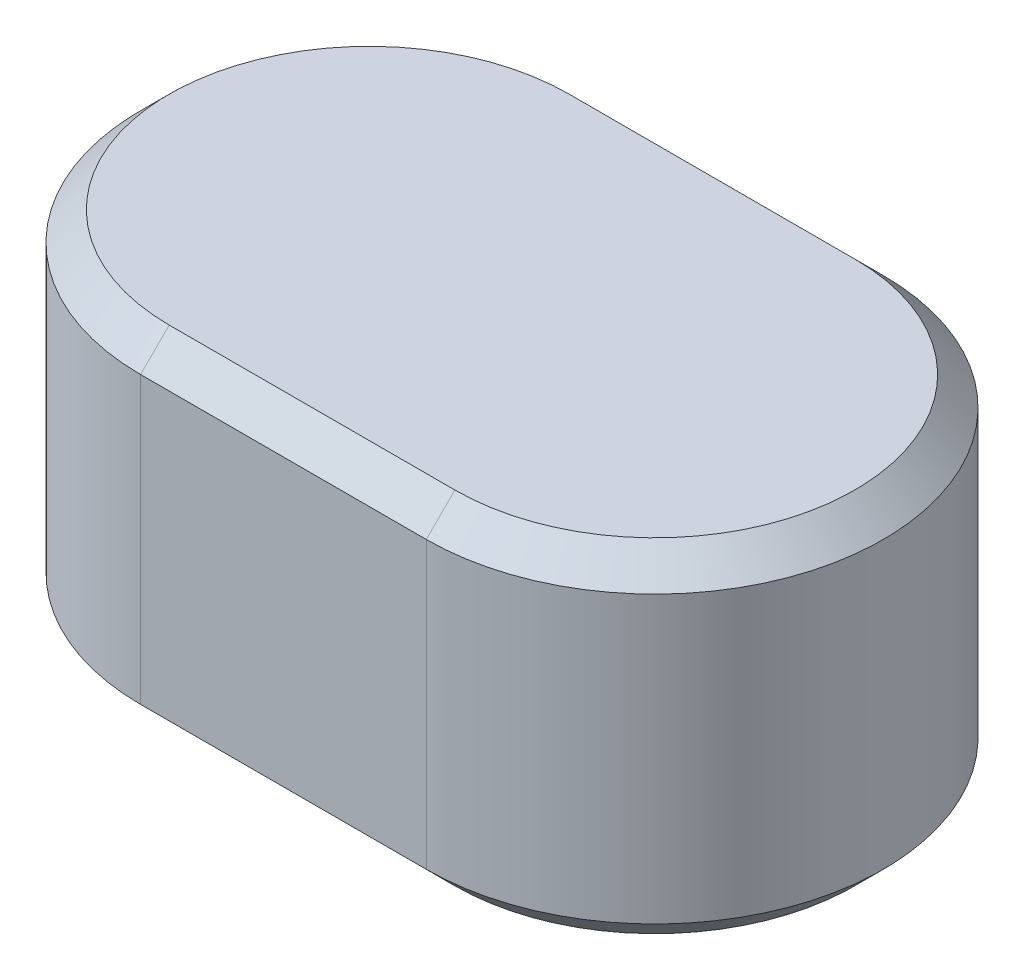
from build123d import *

# Parameters (mm, degrees)
ESTRUSIONE_ESTRUSIONE1_DEPTH = 6
SMUSSO1_SIZE                 = 0.5


with BuildPart() as part:
    # Schizzo1 → Estrusione-Estrusione1 (new body)
    with BuildSketch(Plane(origin=(0, 0, 0), x_dir=(1, 0, 0), z_dir=(0, 1, 0))):
        with BuildLine():
            Line((-2.5, 4), (2.5, 4))
            ThreePointArc((2.5, 4), (6.5, 0), (2.5, -4))
            Line((2.5, -4), (-2.5, -4))
            ThreePointArc((-2.5, -4), (-6.5, 0), (-2.5, 4))
        make_face()
    extrude(amount=ESTRUSIONE_ESTRUSIONE1_DEPTH)

    # Smusso1
    smusso1_edges = [part.edges().sort_by_distance(p)[0] for p in [
        (6.5, 6, 0),
        (0, 6, -4),
        (-6.5, 6, 0),
        (0, 0, -4),
        (6.5, 0, 0),
        (0, 0, 4),
        (-6.5, 0, 0),
        (0, 6, 4),
    ]]
    chamfer(smusso1_edges, length=SMUSSO1_SIZE)


solid = part.part
